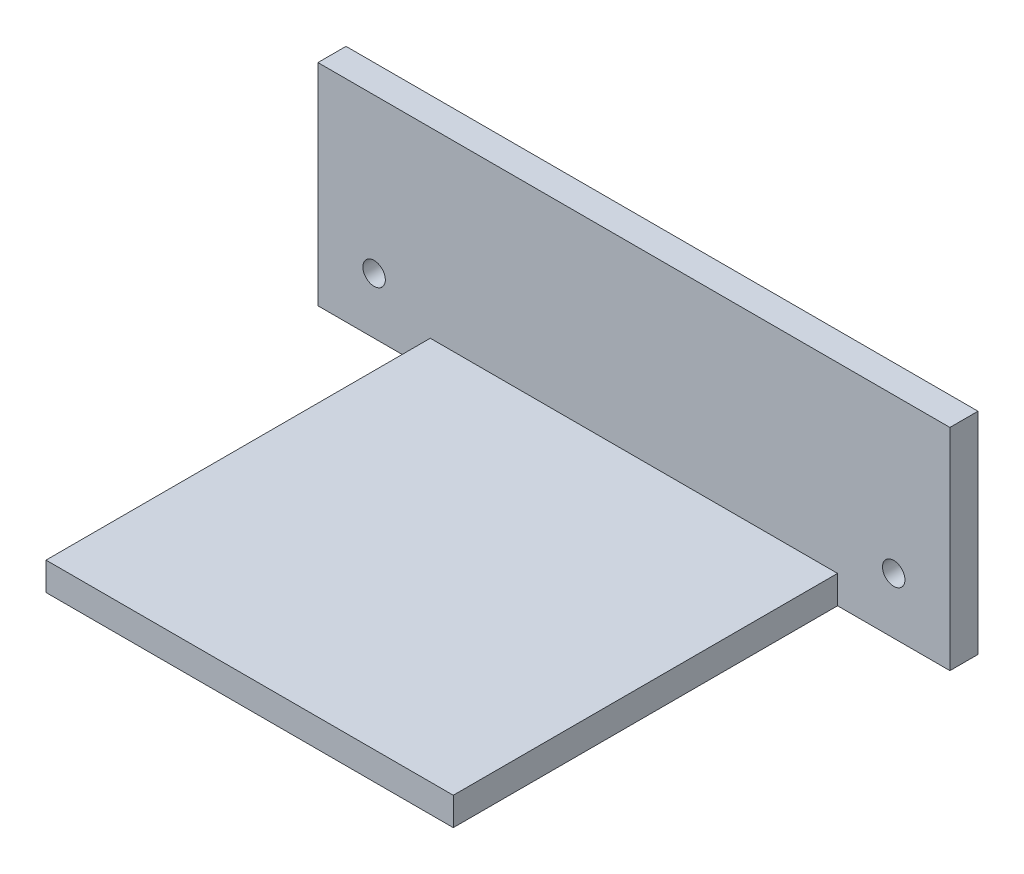
from build123d import *

# Parameters (mm, degrees)
SKETCH2_W                   = 29
SKETCH2_H                   = 27.475014389
BOSS_EXTRUDE1_DEPTH         = 2
SKETCH7_W                   = 45
SKETCH7_H                   = 2
BOSS_EXTRUDE2_DEPTH         = 15
TAP_DRILL_FOR_M2X0_4_TAP1_D = 1.6
TAP_DRILL_FOR_M2X0_4_TAP2_D = 1.6


with BuildPart() as part:
    # Sketch2 → Boss-Extrude1 (new body)
    with BuildSketch(Plane(origin=(0, 0, 0), x_dir=(1, 0, 0), z_dir=(0, 1, 0))):
        with Locations((-24.397211382, -13.737507195)):
            Rectangle(SKETCH2_W, SKETCH2_H)
    extrude(amount=BOSS_EXTRUDE1_DEPTH)

    # Sketch7 → Boss-Extrude2 (add)
    with BuildSketch(Plane(origin=(0, 0, 0), x_dir=(-1, 0, 0), z_dir=(0, -1, 0))):
        with Locations((24.397211382, 0.886680676)):
            Rectangle(SKETCH7_W, SKETCH7_H)
    extrude(amount=-BOSS_EXTRUDE2_DEPTH)

    # Tap Drill for M2x0.4 Tap1 (through all)
    with Locations(Plane.XY.offset(0.113319324)):
        with Locations((-42.897211382, 4)):
            Hole(TAP_DRILL_FOR_M2X0_4_TAP1_D / 2)

    # Tap Drill for M2x0.4 Tap2 (through all)
    with Locations(Plane.XY.offset(0.113319324)):
        with Locations((-5.897211382, 4)):
            Hole(TAP_DRILL_FOR_M2X0_4_TAP2_D / 2)


solid = part.part
